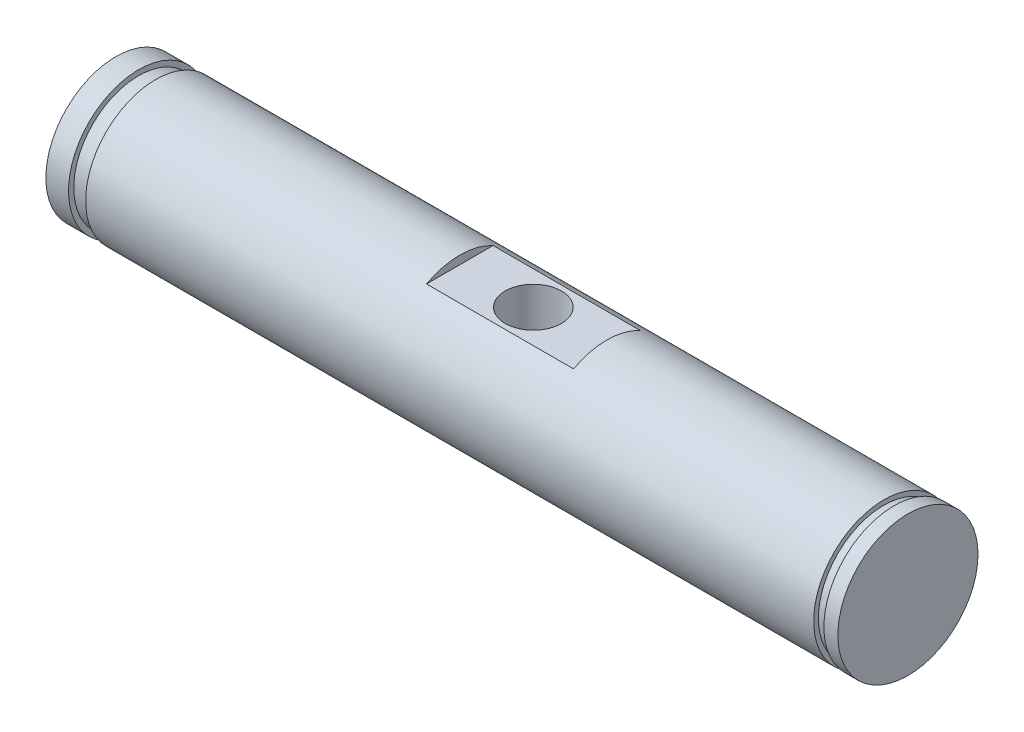
from build123d import *

# Parameters (mm, degrees)
SKETCH1_R               = 6.35
BOSS_EXTRUDE1_DEPTH     = 28.575
SKETCH2_W               = 0.924673016
SKETCH2_H               = 0.42538178
BOSS_EXTRUDE3_START     = -43.18
SKETCH7_R               = 6.35
BOSS_EXTRUDE3_DEPTH     = 43.18
SKETCH8_W               = 1.548924628
SKETCH8_H               = 0.472995579
F_1_4_20_TAPPED_HOLE2_D = 5.1054
SKETCH17_W              = 13.324603024
SKETCH17_H              = 8.990077112
CUT_EXTRUDE3_DEPTH      = 0.762


with BuildPart() as part:
    # Sketch1 → Boss-Extrude1 (new body)
    with BuildSketch(Plane(origin=(0, 0, 0), x_dir=(0, 0, -1), z_dir=(1, 0, 0))):
        Circle(SKETCH1_R)
    extrude(amount=BOSS_EXTRUDE1_DEPTH)

    # Sketch2 → Cut-Revolve1 (revolve, cut)
    with BuildSketch(Plane.XY, mode=Mode.PRIVATE) as cut_revolve1_sk:
        with Locations((26.848530558, 6.13730911)):
            Rectangle(SKETCH2_W, SKETCH2_H)
    revolve(cut_revolve1_sk.sketch.rotate(Axis((28.575, 0, 0), (-1, 0, 0)), 90), axis=Axis((28.575, 0, 0), (-1, 0, 0)), mode=Mode.SUBTRACT)

    # Sketch7 → Boss-Extrude3 (add)
    with BuildSketch(Plane(origin=(0, 0, 0), x_dir=(0, 0, -1), z_dir=(1, 0, 0)).offset(BOSS_EXTRUDE3_START)):
        Circle(SKETCH7_R)
    extrude(amount=BOSS_EXTRUDE3_DEPTH)

    # Sketch8 → Cut-Revolve2 (revolve, cut)
    with BuildSketch(Plane.XY, mode=Mode.PRIVATE) as cut_revolve2_sk:
        with Locations((-40.352206887, 6.113502211)):
            Rectangle(SKETCH8_W, SKETCH8_H)
    revolve(cut_revolve2_sk.sketch.rotate(Axis((28.575, 0, 0), (-1, 0, 0)), 90), axis=Axis((28.575, 0, 0), (-1, 0, 0)), mode=Mode.SUBTRACT)

    # 1/4-20 Tapped Hole2 (through all)
    with Locations(Plane(origin=(0, 6.35, 0), x_dir=(1, 0, 0), z_dir=(0, 1, 0))):
        with Locations((-5.36380595, 0)):
            Hole(F_1_4_20_TAPPED_HOLE2_D / 2)

    # Sketch17 → Cut-Extrude3 (cut)
    with BuildSketch(Plane(origin=(0, 6.35, 0), x_dir=(1, 0, 0), z_dir=(0, 1, 0))):
        with Locations((-5.36380595, 0)):
            Rectangle(SKETCH17_W, SKETCH17_H)
    extrude(amount=-CUT_EXTRUDE3_DEPTH, mode=Mode.SUBTRACT)


solid = part.part
